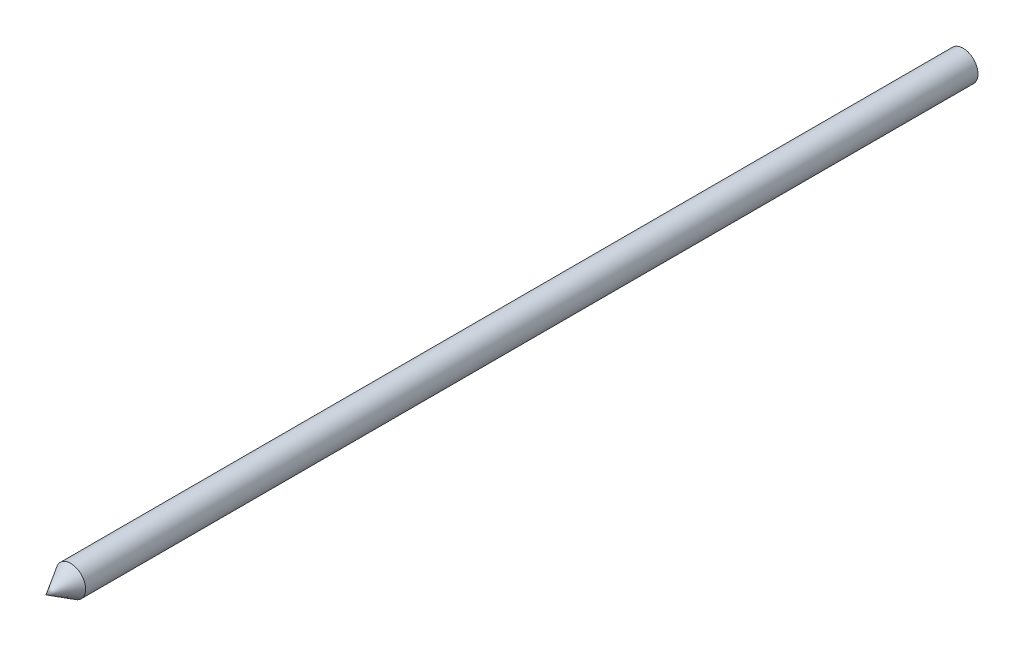
from build123d import *

# Parameters (mm, degrees)
ESQUISSE1_R        = 15
BOSS_EXTRU_1_DEPTH = 900
ESQUISSE2_R        = 15
BOSS_EXTRU_2_DEPTH = 30
BOSS_EXTRU_2_TAPER = 31


with BuildPart() as part:
    # Esquisse1 → Boss.-Extru.1 (new body)
    with BuildSketch(Plane.XY):
        Circle(ESQUISSE1_R)
    extrude(amount=BOSS_EXTRU_1_DEPTH)

    # Esquisse2 → Boss.-Extru.2 (add)
    with BuildSketch(Plane.XY.offset(900)):
        Circle(ESQUISSE2_R)
    extrude(amount=BOSS_EXTRU_2_DEPTH, taper=BOSS_EXTRU_2_TAPER)


solid = part.part
